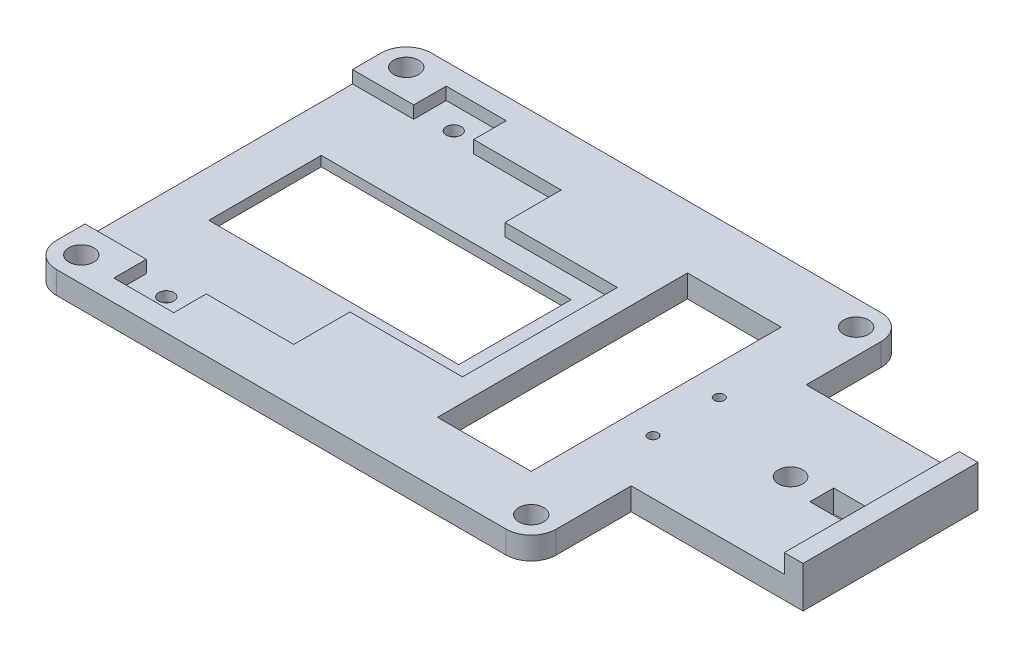
from build123d import *

# Parameters (mm, degrees)
SKETCH2_W                = 136.525
SKETCH2_H                = 76.2
CHASSIS_BASE_DEPTH       = 4.572
SKETCH2_2_W              = 136.525
SKETCH2_2_H              = 76.2
BOSS_EXTRUDE2_DEPTH      = 4.572
SKETCH4_W                = 34.925
SKETCH4_H                = 20.32
CORNER_CUTOUTS_DEPTH     = 79.308888961
CUT_EXTRUDE2_DEPTH       = 2.54
CIRCLE_R                 = 1.524
CIRCLE_THROUGH_ALL_DEPTH = 79.216561585
FILLET4_R                = 5.08
SKETCH10_W               = 50.8
SKETCH10_H               = 22.86
RESISTANCE_SENSOR_DEPTH  = 79.216561585
SKETCH11_R               = 2.54
CORNER_HOLES_DEPTH       = 79.308888961
CUT_EXTRUDE7_DEPTH       = 79.216561585
CUT_EXTRUDE7_DEPTH_BACK  = 79.216561585
SKETCH12_R               = 1.016
SKETCH12_W               = 19.05
SKETCH12_H               = 50.8
SKETCH16_W               = 6.35
SKETCH16_H               = 4.826
CUT_EXTRUDE11_DEPTH      = 79.308888961
SKETCH17_R               = 2.4892
CUT_EXTRUDE12_DEPTH      = 79.308888961
CUT_EXTRUDE13_DEPTH      = 1.27
SKETCH19_W               = 3.81
SKETCH19_H               = 35.56
BOSS_EXTRUDE4_DEPTH      = 3.81


with BuildPart() as part:
    # Sketch2 → Chassis Base (new body)
    with BuildSketch(Plane(origin=(0, 0, 0), x_dir=(1, 0, 0), z_dir=(0, 1, 0))):
        Rectangle(SKETCH2_W, SKETCH2_H)
    extrude(amount=CHASSIS_BASE_DEPTH)

    # Sketch2<2> → Boss-Extrude2 (add)
    with BuildSketch(Plane(origin=(0, 0, 0), x_dir=(1, 0, 0), z_dir=(0, 1, 0))):
        Rectangle(SKETCH2_2_W, SKETCH2_2_H)
    extrude(amount=BOSS_EXTRUDE2_DEPTH)

    # Sketch4 → Corner Cutouts (cut, through all)
    with BuildSketch(Plane.XZ):
        with Locations((50.8, -27.94)):
            Rectangle(SKETCH4_W, SKETCH4_H)
        with Locations((50.8, 27.94)):
            Rectangle(SKETCH4_W, SKETCH4_H)
    extrude(amount=-CORNER_CUTOUTS_DEPTH, mode=Mode.SUBTRACT)

    # Lines → Cut-Extrude2 (cut)
    with BuildSketch(Plane(origin=(0, 4.572, 0), x_dir=(1, 0, 0), z_dir=(0, 1, 0))):
        Polygon((-68.2625, -27.178), (-55.8165, -27.178), (-55.8165, -33.782), (-43.6245, -33.782), (-43.6245, -27.178), (-25.8445, -27.178), (-25.8445, -15.748), (-2.9845, -15.748), (-2.9845, 15.748), (-25.8445, 15.748), (-25.8445, 27.178), (-43.6245, 27.178), (-43.6245, 33.782), (-55.8165, 33.782), (-55.8165, 27.178), (-68.2625, 27.178), align=None)
    extrude(amount=-CUT_EXTRUDE2_DEPTH, mode=Mode.SUBTRACT)

    # Circle → Circle Through All (cut, through all)
    with BuildSketch(Plane(origin=(0, 2.032, 0), x_dir=(1, 0, 0), z_dir=(0, 1, 0))):
        with Locations(Location((-49.7205, -29.21, 0), (0, 0, 270))):
            Circle(CIRCLE_R)
        with Locations(Location((-49.7205, 29.21, 0), (0, 0, 90))):
            Circle(CIRCLE_R)
    extrude(amount=-CIRCLE_THROUGH_ALL_DEPTH, mode=Mode.SUBTRACT)

    # Fillet4
    fillet4_edges = [part.edges().sort_by_distance(p)[0] for p in [
        (33.3375, 2.286, -38.1),
        (33.3375, 2.286, 38.1),
        (-68.2625, 2.286, -38.1),
        (-68.2625, 2.286, 38.1),
    ]]
    fillet(fillet4_edges, radius=FILLET4_R)

    # Sketch10 → resistance sensor (cut, through all)
    with BuildSketch(Plane(origin=(0, 2.032, 0), x_dir=(1, 0, 0), z_dir=(0, 1, 0))):
        with Locations((-33.4645, 0)):
            Rectangle(SKETCH10_W, SKETCH10_H)
    extrude(amount=-RESISTANCE_SENSOR_DEPTH, mode=Mode.SUBTRACT)

    # Sketch11 → corner holes (cut, through all)
    with BuildSketch(Plane(origin=(0, 4.572, 0), x_dir=(1, 0, 0), z_dir=(0, 1, 0))):
        with Locations(Location((-63.1825, 33.02, 0), (0, 0, 270))):
            Circle(SKETCH11_R)
        with Locations(Location((28.2575, 33.02, 0), (0, 0, 90))):
            Circle(SKETCH11_R)
        with Locations(Location((-63.1825, -33.02, 0), (0, 0, 90))):
            Circle(SKETCH11_R)
        with Locations(Location((28.2575, -33.02, 0), (0, 0, 270))):
            Circle(SKETCH11_R)
    extrude(amount=-CORNER_HOLES_DEPTH, mode=Mode.SUBTRACT)

    # Sketch12 → Cut-Extrude7 (cut, two sides: drawn at the far end of the back side and taken through both)
    with BuildSketch(Plane(origin=(0, 2.032, 0), x_dir=(1, 0, 0), z_dir=(0, 1, 0)).offset(-CUT_EXTRUDE7_DEPTH_BACK)):
        with Locations(Location((26.7335, -6.731, 0), (0, 0, 270))):
            Circle(SKETCH12_R)
        with Locations(Location((26.7335, 6.731, 0), (0, 0, 90))):
            Circle(SKETCH12_R)
        with Locations((11.1125, 0)):
            Rectangle(SKETCH12_W, SKETCH12_H)
    extrude(amount=CUT_EXTRUDE7_DEPTH + CUT_EXTRUDE7_DEPTH_BACK, mode=Mode.SUBTRACT)

    # Sketch16 → Cut-Extrude11 (cut, through all)
    with BuildSketch(Plane(origin=(0, 4.572, 0), x_dir=(1, 0, 0), z_dir=(0, 1, 0))):
        with Locations((57.4675, 0)):
            Rectangle(SKETCH16_W, SKETCH16_H)
    extrude(amount=-CUT_EXTRUDE11_DEPTH, mode=Mode.SUBTRACT)

    # Sketch17 → Cut-Extrude12 (cut, through all)
    with BuildSketch(Plane(origin=(0, 4.572, 0), x_dir=(1, 0, 0), z_dir=(0, 1, 0))):
        with Locations(Location((47.9425, 0, 0), (0, 0, 270))):
            Circle(SKETCH17_R)
    extrude(amount=-CUT_EXTRUDE12_DEPTH, mode=Mode.SUBTRACT)

    # Sketch18 → Cut-Extrude13 (cut)
    # profile 1 of 5: a face of its own
    with BuildSketch(Plane.XZ):
        with BuildLine():
            add(Edge.make_bspline(
                [(-33.702772205, -32.937203509), (-33.703598143, -33.02845504), (-33.705333053, -33.220131806), (-33.705378986, -33.521319359), (-33.709066322, -33.849800879), (-33.712761289, -34.138175691), (-33.714963296, -34.374614628), (-33.718439752, -34.546867394), (-33.721526048, -34.710761461), (-33.724612791, -34.865938747), (-33.72789546, -35.013090421), (-33.730587927, -35.151550246), (-33.735112427, -35.281601123), (-33.737993241, -35.365288069), (-33.739385689, -35.405738309)],
                knots=[0, 0, 0, 0, 1.330626348, 2.7950233, 4.391685999, 6.12059717, 7.000305762, 7.839416787, 8.632773681, 9.390544697, 10.102563453, 10.778998041, 11.409826442, 12, 12, 12, 12], degree=3))
            add(Edge.make_bspline(
                [(-33.739385689, -35.405738309), (-33.768327502, -35.409234362), (-33.83248073, -35.416983812), (-33.938141271, -35.429526589), (-34.062641053, -35.444079448), (-34.199605701, -35.460468397), (-34.336402659, -35.474890146), (-34.460092543, -35.489102134), (-34.564431712, -35.49920428), (-34.627550021, -35.505459716), (-34.65579444, -35.508258922)],
                knots=[0, 0, 0, 0, 0.75871927, 1.681798207, 2.769238559, 4.021041382, 5.271823924, 6.349219828, 7.26130266, 8, 8, 8, 8], degree=3))
            Line((-34.65579444, -35.508258922), (-34.690872443, -35.633794368))
            Line((-34.690872443, -35.633794368), (-31.888414176, -35.633794368))
            Line((-31.888414176, -35.633794368), (-31.917958117, -35.508258922))
            add(Edge.make_bspline(
                [(-31.917958117, -35.508258922), (-31.94519292, -35.505432324), (-32.007975814, -35.498916323), (-32.114793949, -35.488841023), (-32.24651708, -35.474708008), (-32.395177404, -35.460442989), (-32.543351452, -35.444452526), (-32.674806168, -35.429726522), (-32.781201209, -35.417460189), (-32.843906764, -35.409283924), (-32.871098858, -35.405738309)],
                knots=[0, 0, 0, 0, 0.685471795, 1.5801805, 2.685974342, 4.001975441, 5.318873838, 6.416921702, 7.313502363, 8, 8, 8, 8], degree=3))
            add(Edge.make_bspline(
                [(-32.871098858, -35.405738309), (-32.874138312, -35.320659894), (-32.880589906, -35.140071021), (-32.885476038, -34.853018948), (-32.894092619, -34.53434684), (-32.898315756, -34.19327846), (-32.902545611, -33.849452346), (-32.905663218, -33.522012459), (-32.907865964, -33.221075479), (-32.908471188, -33.02928289), (-32.908759492, -32.937920679)],
                knots=[0, 0, 0, 0, 0.827787113, 1.757074824, 2.79152534, 3.927552477, 5.073705597, 6.13505851, 7.111617519, 8, 8, 8, 8], degree=3))
            Line((-32.908759492, -32.937920679), (-32.907714385, -32.60758102))
            add(Edge.make_bspline(
                [(-32.907714385, -32.60758102), (-32.907861914, -32.531482837), (-32.908168994, -32.373085708), (-32.90565813, -32.126816918), (-32.902343534, -31.862847889), (-32.899826982, -31.634770862), (-32.894883149, -31.452080957), (-32.893441615, -31.324776533), (-32.890456586, -31.20968499), (-32.885676819, -31.107210678), (-32.882771665, -31.016875079), (-32.880052488, -30.938721487), (-32.875690702, -30.872484003), (-32.87252916, -30.8324094), (-32.871098858, -30.814279395)],
                knots=[0, 0, 0, 0, 1.527084951, 3.178602462, 4.942148896, 6.824739446, 7.755670849, 8.60950548, 9.379539168, 10.065885191, 10.668053807, 11.193301322, 11.635044395, 12, 12, 12, 12], degree=3))
            add(Edge.make_bspline(
                [(-32.871098858, -30.814279395), (-32.775178336, -30.816375101), (-32.582476854, -30.820585312), (-32.292786393, -30.839576476), (-32.001201884, -30.870593955), (-31.759192401, -30.903372857), (-31.571970644, -30.935633002), (-31.443807878, -30.959247373), (-31.329128742, -30.984449322), (-31.227090289, -31.009248014), (-31.138232094, -31.034937095), (-31.062429595, -31.062177121), (-30.999371199, -31.089458511), (-30.96348015, -31.111044647), (-30.947268158, -31.120795108)],
                knots=[0, 0, 0, 0, 1.761064907, 3.537927135, 5.327106968, 7.14307567, 8.01968469, 8.81438351, 9.535076163, 10.174712332, 10.74185694, 11.231870149, 11.653035633, 12, 12, 12, 12], degree=3))
            add(Edge.make_bspline(
                [(-30.947268158, -31.120795108), (-30.946391758, -31.143458533), (-30.944531559, -31.191562689), (-30.94543048, -31.268999734), (-30.944897718, -31.355826869), (-30.946533225, -31.486265533), (-30.951334144, -31.66062272), (-30.956246741, -31.802874042), (-30.958775574, -31.876100037)],
                knots=[0, 0, 0, 0, 0.540260251, 1.146727055, 1.844579267, 2.608938745, 4.254400499, 6, 6, 6, 6], degree=3))
            Line((-30.958775574, -31.876100037), (-30.832195022, -31.919036265))
            add(Edge.make_bspline(
                [(-30.832195022, -31.919036265), (-30.830117163, -31.896702772), (-30.825474294, -31.846799741), (-30.817475281, -31.76475329), (-30.805186845, -31.66832746), (-30.792868066, -31.557758279), (-30.779786175, -31.432781757), (-30.762290679, -31.294163583), (-30.7449934, -31.140982052), (-30.725461629, -30.97887355), (-30.706363399, -30.817020179), (-30.687561291, -30.665674785), (-30.669967123, -30.52964835), (-30.652898401, -30.409435499), (-30.638498637, -30.304389663), (-30.625125277, -30.214725705), (-30.612474102, -30.140517028), (-30.604513088, -30.096281615), (-30.600999555, -30.076758654)],
                knots=[0, 0, 0, 0, 0.579771428, 1.295469156, 2.130605229, 3.092125012, 4.171097047, 5.378518324, 6.703360754, 8.155632211, 9.598953579, 10.915923518, 12.097637568, 13.14415905, 14.054286067, 14.838241834, 15.487266906, 16, 16, 16, 16], degree=3))
            Line((-30.600999555, -30.076758654), (-30.781578329, -30.105475091))
            add(Edge.make_bspline(
                [(-30.781578329, -30.105475091), (-30.789518553, -30.143998715), (-30.806198417, -30.224924501), (-30.828331171, -30.345683623), (-30.849565879, -30.457079623), (-30.864513215, -30.52557071), (-30.870900762, -30.554839475)],
                knots=[0, 0, 0, 0, 1.030142935, 2.16400017, 3.215409641, 4, 4, 4, 4], degree=3))
            add(Edge.make_bspline(
                [(-30.870900762, -30.554839475), (-30.883445808, -30.556323123), (-30.914744569, -30.560024692), (-30.971651332, -30.563720773), (-31.04801904, -30.56788432), (-31.143925294, -30.571994272), (-31.259375172, -30.575769834), (-31.394276438, -30.581781204), (-31.549156013, -30.585026556), (-31.783795056, -30.592748084), (-32.095186039, -30.600485644), (-32.481227455, -30.606461873), (-32.878761634, -30.610774302), (-33.147973164, -30.611837885), (-33.284319699, -30.612376554)],
                knots=[0, 0, 0, 0, 0.188322618, 0.469847995, 0.849958105, 1.328735339, 1.901024075, 2.572223004, 3.341983892, 4.21063745, 6.072535026, 7.986090696, 9.967090691, 12, 12, 12, 12], degree=3))
            add(Edge.make_bspline(
                [(-33.284319699, -30.612376554), (-33.533303403, -30.610894644), (-34.02225272, -30.607984498), (-34.566956607, -30.596874691), (-34.912428586, -30.585010848), (-35.062078606, -30.581752933), (-35.193491765, -30.575756484), (-35.306850432, -30.571985279), (-35.402056205, -30.567834621), (-35.479468612, -30.563644403), (-35.538808582, -30.559958994), (-35.572210829, -30.55632018), (-35.585802864, -30.554839475)],
                knots=[0, 0, 0, 0, 3.244040555, 6.37058324, 7.0978683, 7.747816289, 8.32072437, 8.811738682, 9.225579453, 9.562275481, 9.82188124, 10, 10, 10, 10], degree=3))
            add(Edge.make_bspline(
                [(-35.585802864, -30.554839475), (-35.590559934, -30.513365183), (-35.600382748, -30.427725451), (-35.610618123, -30.301358685), (-35.619859633, -30.185947443), (-35.624570523, -30.114772548), (-35.626601884, -30.084081555)],
                knots=[0, 0, 0, 0, 1.059980831, 2.188740799, 3.218975397, 4, 4, 4, 4], degree=3))
            Line((-35.626601884, -30.084081555), (-35.778291568, -30.054858399))
            add(Edge.make_bspline(
                [(-35.778291568, -30.054858399), (-35.779109696, -30.1315546), (-35.780779991, -30.288138198), (-35.787694661, -30.52777808), (-35.802252217, -30.777410364), (-35.819070712, -31.030610979), (-35.839855131, -31.2738087), (-35.855139777, -31.494046279), (-35.872885045, -31.683923455), (-35.882635398, -31.800772007), (-35.887087933, -31.854131334)],
                knots=[0, 0, 0, 0, 1.020902502, 2.08428298, 3.190586408, 4.348989111, 5.461787099, 6.439309197, 7.287304727, 8, 8, 8, 8], degree=3))
            Line((-35.887087933, -31.854131334), (-35.725192363, -31.809162102))
            add(Edge.make_bspline(
                [(-35.725192363, -31.809162102), (-35.71545437, -31.74706555), (-35.695910507, -31.622439619), (-35.665327308, -31.440288698), (-35.635518725, -31.271767194), (-35.606395568, -31.168052242), (-35.593125765, -31.120795108)],
                knots=[0, 0, 0, 0, 1.07526635, 2.158027564, 3.160715617, 4, 4, 4, 4], degree=3))
            add(Edge.make_bspline(
                [(-35.593125765, -31.120795108), (-35.580361155, -31.112201424), (-35.552835473, -31.093669953), (-35.504809627, -31.068556822), (-35.44731879, -31.043847269), (-35.38048627, -31.01918181), (-35.304711923, -30.993420032), (-35.219034508, -30.970551023), (-35.124453848, -30.944772249), (-35.019973119, -30.919513038), (-34.904098663, -30.896616073), (-34.776123041, -30.875510362), (-34.635107521, -30.858141399), (-34.480918893, -30.843472759), (-34.313785766, -30.832525065), (-34.133859008, -30.822847413), (-33.940979163, -30.816637469), (-33.808085796, -30.815082992), (-33.739385689, -30.814279395)],
                knots=[0, 0, 0, 0, 0.389041187, 0.838930788, 1.368286178, 1.971244365, 2.640738876, 3.392006404, 4.213672846, 5.120859182, 6.110426022, 7.200997897, 8.401287125, 9.703895375, 11.118645378, 12.637995816, 14.261989656, 16, 16, 16, 16], degree=3))
            add(Edge.make_bspline(
                [(-33.739385689, -30.814279395), (-33.737942282, -30.830664591), (-33.734658791, -30.867937979), (-33.730430536, -30.930351173), (-33.727743346, -31.005717111), (-33.724503155, -31.093587246), (-33.721396793, -31.194367242), (-33.718365122, -31.308049063), (-33.71488523, -31.434966911), (-33.712742323, -31.618756603), (-33.708988428, -31.849591328), (-33.705457404, -32.117398445), (-33.70501216, -32.368478864), (-33.704206333, -32.530279453), (-33.703817312, -32.608390135)],
                knots=[0, 0, 0, 0, 0.329934336, 0.750541551, 1.254589287, 1.842509769, 2.514318579, 3.277018032, 4.123623988, 5.061003967, 6.963739231, 8.754478227, 10.433195345, 12, 12, 12, 12], degree=3))
            Line((-33.703817312, -32.608390135), (-33.702772205, -32.937203509))
        make_face()
    # profile 2 of 5: a face of its own
    with BuildSketch(Plane.XZ):
        with BuildLine():
            add(Edge.make_bspline(
                [(-27.251898172, -35.767698843), (-27.14067772, -35.764311776), (-26.922618032, -35.757671068), (-26.603830965, -35.716600121), (-26.29995869, -35.655080644), (-26.012210018, -35.566590368), (-25.739973448, -35.454956469), (-25.484537959, -35.317447754), (-25.243276324, -35.158734883), (-25.058153285, -35.004443988), (-24.918608884, -34.871624623), (-24.821536956, -34.765448835), (-24.73028793, -34.655561965), (-24.645253494, -34.541149573), (-24.566386092, -34.422046989), (-24.495969307, -34.29686386), (-24.429098445, -34.168454969), (-24.37125937, -34.03416413), (-24.318119325, -33.895936844), (-24.274151327, -33.752229577), (-24.233417449, -33.604654162), (-24.201673879, -33.451490367), (-24.175027198, -33.29383193), (-24.15719632, -33.131349802), (-24.142449612, -32.964669116), (-24.139507996, -32.851822621), (-24.138016377, -32.794601046)],
                knots=[0, 0, 0, 0, 1.654520043, 3.24386492, 4.775090929, 6.261827658, 7.715597549, 9.145277746, 10.571150381, 12.004552925, 12.72368617, 13.435937959, 14.143336704, 14.847838136, 15.555750295, 16.266773003, 16.983694851, 17.708494173, 18.440755566, 19.185660995, 19.943230337, 20.717524926, 21.511536697, 22.321039648, 23.148642092, 24, 24, 24, 24], degree=3))
            add(Edge.make_bspline(
                [(-24.138016377, -32.794601046), (-24.140608697, -32.706567622), (-24.145780113, -32.530949878), (-24.188341569, -32.270081443), (-24.256306284, -32.013806886), (-24.335599704, -31.805961834), (-24.411662626, -31.644829689), (-24.475552614, -31.528458756), (-24.546054751, -31.417207878), (-24.622286016, -31.310483813), (-24.705022118, -31.208407771), (-24.795273204, -31.112744285), (-24.890649221, -31.02087723), (-24.958527768, -30.964177657), (-24.992703534, -30.935630326)],
                knots=[0, 0, 0, 0, 1.497468564, 2.987297775, 4.485800779, 6.00346457, 6.76531872, 7.516957734, 8.261133263, 9.005498066, 9.747896811, 10.495259908, 11.242387355, 12, 12, 12, 12], degree=3))
            add(Edge.make_bspline(
                [(-24.992703534, -30.935630326), (-25.070246118, -30.885909145), (-25.222151893, -30.788505447), (-25.46169693, -30.67203661), (-25.70152636, -30.578019856), (-25.946993732, -30.513524114), (-26.197838356, -30.469689092), (-26.457591706, -30.437773454), (-26.728005827, -30.421213243), (-26.911981221, -30.421028741), (-27.005455175, -30.420935)],
                knots=[0, 0, 0, 0, 1.045468158, 2.048070122, 3.019776725, 3.967121396, 4.925071677, 5.910597291, 6.938419277, 8, 8, 8, 8], degree=3))
            add(Edge.make_bspline(
                [(-27.005455175, -30.420935), (-27.067546223, -30.422967782), (-27.19008247, -30.426979464), (-27.371116469, -30.439978031), (-27.546831513, -30.456762048), (-27.71694268, -30.482701932), (-27.88164765, -30.512809725), (-28.041245371, -30.54746318), (-28.194098466, -30.591900434), (-28.342995206, -30.637320101), (-28.485415938, -30.693076932), (-28.62356261, -30.751716604), (-28.755286785, -30.817985236), (-28.881711554, -30.889502), (-29.00262107, -30.966555992), (-29.118323138, -31.049543348), (-29.228384901, -31.138584721), (-29.366176208, -31.264407076), (-29.523971995, -31.431248144), (-29.691760883, -31.64365229), (-29.832359501, -31.869379538), (-29.949688599, -32.105407946), (-30.039676747, -32.353732723), (-30.104302518, -32.613159857), (-30.146663933, -32.883546862), (-30.152426812, -33.068179332), (-30.155348724, -33.161792223)],
                knots=[0, 0, 0, 0, 0.955876937, 1.886416398, 2.792499174, 3.671270352, 4.533252654, 5.369032349, 6.182765502, 6.982075569, 7.763369315, 8.534891058, 9.290804328, 10.030916141, 10.769236196, 11.495940819, 12.220840406, 12.946355399, 14.365929964, 15.749574664, 17.104431243, 18.45069603, 19.798521208, 21.15982306, 22.559965237, 24, 24, 24, 24], degree=3))
            add(Edge.make_bspline(
                [(-30.155348724, -33.161792223), (-30.15430078, -33.247295021), (-30.152242406, -33.415239842), (-30.12544672, -33.661577318), (-30.080784096, -33.897628672), (-30.015676038, -34.124589938), (-29.927459876, -34.345973854), (-29.807685562, -34.560273908), (-29.664977474, -34.774936399), (-29.550121962, -34.908262158), (-29.491056992, -34.976825537)],
                knots=[0, 0, 0, 0, 1.034515342, 2.031997759, 2.994717118, 3.939165266, 4.885977753, 5.871954466, 6.905642885, 8, 8, 8, 8], degree=3))
            add(Edge.make_bspline(
                [(-29.491056992, -34.976825537), (-29.448662443, -35.017134707), (-29.365323353, -35.096374365), (-29.233306218, -35.204229185), (-29.100080082, -35.302769582), (-28.96386678, -35.390007201), (-28.824948465, -35.465156686), (-28.685050486, -35.531750493), (-28.541914085, -35.586442729), (-28.349186902, -35.643489326), (-28.107923503, -35.698404191), (-27.819876596, -35.743318797), (-27.534927157, -35.768959701), (-27.346192823, -35.768117594), (-27.251898172, -35.767698843)],
                knots=[0, 0, 0, 0, 0.861291258, 1.693124039, 2.508722345, 3.300843965, 4.073052942, 4.833508039, 5.581284352, 6.327029741, 7.792114048, 9.221606161, 10.61839766, 12, 12, 12, 12], degree=3))
        make_face()
        with BuildLine():
            add(Edge.make_bspline(
                [(-26.895829263, -35.508258922), (-26.984523637, -35.502704186), (-27.158480619, -35.491809638), (-27.412028501, -35.445592731), (-27.652978609, -35.378433913), (-27.880543049, -35.285047473), (-28.095934044, -35.170064436), (-28.298367191, -35.030344156), (-28.488194237, -34.867806404), (-28.662417156, -34.682962493), (-28.820157571, -34.483230278), (-28.959925816, -34.273913906), (-29.078722386, -34.056063184), (-29.177689924, -33.830504178), (-29.255349712, -33.59618112), (-29.311737639, -33.353526538), (-29.347925153, -33.102844981), (-29.355445616, -32.932806754), (-29.359244775, -32.846907481)],
                knots=[0, 0, 0, 0, 1.062649301, 2.084182544, 3.077508181, 4.050770289, 5.021569289, 5.993828993, 6.988205842, 8.006520951, 9.028378007, 10.030629867, 11.014727188, 11.993884368, 12.974321098, 13.964231378, 14.971578057, 16, 16, 16, 16], degree=3))
            add(Edge.make_bspline(
                [(-29.359244775, -32.846907481), (-29.35434531, -32.754034104), (-29.344824985, -32.573568536), (-29.30825802, -32.312805485), (-29.253510281, -32.070964136), (-29.178885157, -31.84838559), (-29.086336977, -31.644304506), (-28.973393809, -31.459929079), (-28.843182536, -31.293698759), (-28.693654648, -31.148937999), (-28.533126646, -31.022731598), (-28.367229368, -30.912271687), (-28.197248711, -30.818141536), (-28.021526333, -30.742656122), (-27.841157941, -30.683934534), (-27.656366173, -30.641804376), (-27.466780141, -30.617133728), (-27.338893512, -30.614667924), (-27.274310253, -30.613422683)],
                knots=[0, 0, 0, 0, 1.302559707, 2.531050155, 3.684202301, 4.771875286, 5.814676407, 6.816822024, 7.794260883, 8.765083759, 9.724965173, 10.65181382, 11.554869737, 12.443376475, 13.327128818, 14.208934328, 15.095504675, 16, 16, 16, 16], degree=3))
            add(Edge.make_bspline(
                [(-27.274310253, -30.613422683), (-27.197799992, -30.61744998), (-27.04664853, -30.625406194), (-26.82455963, -30.664227035), (-26.612101487, -30.728594423), (-26.406715756, -30.811018916), (-26.212282085, -30.921209064), (-26.025044976, -31.050785247), (-25.847749195, -31.205194522), (-25.680585013, -31.3797719), (-25.526659194, -31.572849669), (-25.39172642, -31.782587468), (-25.27599895, -32.006708616), (-25.180397287, -32.245616611), (-25.105792988, -32.499432487), (-25.04922129, -32.767278919), (-25.012071835, -33.04958225), (-25.004099937, -33.242929353), (-25.000026435, -33.341726362)],
                knots=[0, 0, 0, 0, 0.932804582, 1.842821793, 2.737983766, 3.633357388, 4.532843208, 5.454388191, 6.403114053, 7.39159831, 8.39538157, 9.406392926, 10.424767149, 11.463676078, 12.536241667, 13.643519346, 14.795879348, 16, 16, 16, 16], degree=3))
            add(Edge.make_bspline(
                [(-25.000026435, -33.341726362), (-25.003348326, -33.417148103), (-25.009861674, -33.565030131), (-25.040127994, -33.781820346), (-25.084018741, -33.98897831), (-25.146541829, -34.186341439), (-25.224822755, -34.373748255), (-25.319647987, -34.551494654), (-25.429850191, -34.719922936), (-25.555732757, -34.876407326), (-25.693161744, -35.019875601), (-25.840833712, -35.145541302), (-25.996455962, -35.253482939), (-26.160914972, -35.341644137), (-26.332936809, -35.41230882), (-26.513705369, -35.463424881), (-26.702229511, -35.49791247), (-26.831302231, -35.504781043), (-26.895829263, -35.508258922)],
                knots=[0, 0, 0, 0, 1.134750352, 2.22494442, 3.287456516, 4.315732293, 5.333470747, 6.337539811, 7.341115772, 8.355823464, 9.353463168, 10.324393736, 11.266969937, 12.196088049, 13.125102564, 14.057913, 15.016630478, 16, 16, 16, 16], degree=3))
        make_face(mode=Mode.SUBTRACT)
    # profile 3 of 5: a face of its own
    with BuildSketch(Plane.XZ):
        with BuildLine():
            Line((-18.464989099, -35.633794368), (-16.107700484, -35.633794368))
            Line((-16.107700484, -35.633794368), (-16.1438522, -35.508258922))
            add(Edge.make_bspline(
                [(-16.1438522, -35.508258922), (-16.163277141, -35.505564373), (-16.204735866, -35.499813386), (-16.270648109, -35.488550282), (-16.345484558, -35.47881806), (-16.454008656, -35.462187112), (-16.588742339, -35.440487367), (-16.694543353, -35.417670957), (-16.745024775, -35.406784437)],
                knots=[0, 0, 0, 0, 0.578804289, 1.235344231, 1.973318314, 2.805923195, 4.475992485, 6, 6, 6, 6], degree=3))
            add(Edge.make_bspline(
                [(-16.745024775, -35.406784437), (-16.751708635, -35.380296951), (-16.766897974, -35.320103079), (-16.790721529, -35.219341766), (-16.817705292, -35.097511868), (-16.849164999, -34.955254925), (-16.884537912, -34.792364444), (-16.924528791, -34.608646148), (-16.968423092, -34.404365572), (-17.064727716, -33.941565386), (-17.215548353, -33.21846), (-17.363162332, -32.489037148), (-17.459343294, -32.004039138), (-17.504645776, -31.779253976), (-17.545381148, -31.571060065), (-17.582085206, -31.379981598), (-17.61407958, -31.206177288), (-17.644109263, -31.049806813), (-17.668653765, -30.910155793), (-17.684421225, -30.822643456), (-17.691771259, -30.781849405)],
                knots=[0, 0, 0, 0, 0.312451515, 0.710058559, 1.184198332, 1.7396684, 2.376473493, 3.090718614, 3.890202177, 4.766301273, 8.497490808, 12.338885421, 13.278308136, 14.152807913, 14.961608928, 15.704725426, 16.378254723, 16.982936425, 17.525893779, 18, 18, 18, 18], degree=3))
            add(Edge.make_bspline(
                [(-17.691771259, -30.781849405), (-17.669131533, -30.776837051), (-17.621182689, -30.76622135), (-17.544621814, -30.752177341), (-17.460128759, -30.735767102), (-17.370294443, -30.722326691), (-17.283087928, -30.709294518), (-17.205338409, -30.697694404), (-17.140485238, -30.688228141), (-17.10140849, -30.682798085), (-17.083970478, -30.68037492)],
                knots=[0, 0, 0, 0, 0.902777855, 1.912000022, 3.030478334, 4.253737315, 5.448096633, 6.463873442, 7.314503002, 8, 8, 8, 8], degree=3))
            Line((-17.083970478, -30.68037492), (-17.062183621, -30.553794368))
            Line((-17.062183621, -30.553794368), (-19.043467628, -30.553796411))
            Line((-19.043467628, -30.553796411), (-19.007310805, -30.679330835))
            add(Edge.make_bspline(
                [(-19.007310805, -30.679330835), (-18.969812338, -30.68561721), (-18.889058377, -30.699155088), (-18.763746293, -30.719945446), (-18.636241484, -30.743538155), (-18.554627723, -30.769567995), (-18.516120683, -30.781849405)],
                knots=[0, 0, 0, 0, 0.908126762, 1.955675498, 3.03544595, 4, 4, 4, 4], degree=3))
            add(Edge.make_bspline(
                [(-18.516120683, -30.781849405), (-18.519802807, -30.796191783), (-18.529053225, -30.832223438), (-18.550878132, -30.895353133), (-18.580033426, -30.979076947), (-18.617721208, -31.082782901), (-18.665159821, -31.206444983), (-18.721699548, -31.350308655), (-18.786329249, -31.51478305), (-18.939891874, -31.893578893), (-19.182848797, -32.487839471), (-19.43111394, -33.085070492), (-19.599397416, -33.478142366), (-19.676125472, -33.656177379), (-19.744565634, -33.817345434), (-19.807680598, -33.960363215), (-19.862719411, -34.086237875), (-19.91202828, -34.193774374), (-19.953965551, -34.284048902), (-19.979630465, -34.338349682), (-19.991162166, -34.362747984)],
                knots=[0, 0, 0, 0, 0.206330486, 0.518353994, 0.930327389, 1.442349601, 2.056186141, 2.776467501, 3.596923127, 4.519366629, 8.473700556, 12.545727429, 13.534334062, 14.433589585, 15.247961308, 15.974919263, 16.612542044, 17.162837773, 17.623848182, 18, 18, 18, 18], degree=3))
            add(Edge.make_bspline(
                [(-19.991162166, -34.362747984), (-20.010028796, -34.315337994), (-20.050492072, -34.213657751), (-20.114717847, -34.049919103), (-20.185014162, -33.863948044), (-20.265383659, -33.656579669), (-20.351458375, -33.426840922), (-20.446256614, -33.175313792), (-20.546886621, -32.90148121), (-20.654864135, -32.613092701), (-20.761844593, -32.323287047), (-20.863758017, -32.045870995), (-20.95627045, -31.787484977), (-21.042747426, -31.548990618), (-21.119601067, -31.32932801), (-21.189984897, -31.129742361), (-21.252064638, -30.949571312), (-21.289528115, -30.83559096), (-21.307192085, -30.781849405)],
                knots=[0, 0, 0, 0, 0.64193762, 1.376764149, 2.212685415, 3.143094487, 4.174628561, 5.299096029, 6.524724979, 7.844822574, 9.173146152, 10.411125717, 11.562902579, 12.625852621, 13.602639804, 14.490607553, 15.288323868, 16, 16, 16, 16], degree=3))
            add(Edge.make_bspline(
                [(-21.307192085, -30.781849405), (-21.268191378, -30.772533637), (-21.186283458, -30.752968986), (-21.056729302, -30.727467173), (-20.915260729, -30.701831993), (-20.816610901, -30.687716964), (-20.765297412, -30.68037492)],
                knots=[0, 0, 0, 0, 0.872324183, 1.832024741, 2.872310515, 4, 4, 4, 4], degree=3))
            Line((-20.765297412, -30.68037492), (-20.735509306, -30.553794368))
            Line((-20.735509306, -30.553794368), (-22.861410391, -30.553796411))
            Line((-22.861410391, -30.553796411), (-22.818024655, -30.679330835))
            add(Edge.make_bspline(
                [(-22.818024655, -30.679330835), (-22.801921181, -30.682189713), (-22.762897406, -30.689117674), (-22.694387817, -30.699067679), (-22.605857243, -30.711915111), (-22.502516692, -30.725331329), (-22.393437769, -30.740812038), (-22.288771037, -30.755073767), (-22.192569574, -30.768974845), (-22.131542771, -30.777673872), (-22.102249905, -30.781849405)],
                knots=[0, 0, 0, 0, 0.542804679, 1.315386201, 2.297446092, 3.511966529, 4.773923042, 5.954041894, 7.017940109, 8, 8, 8, 8], degree=3))
            add(Edge.make_bspline(
                [(-22.102249905, -30.781849405), (-22.10846636, -30.814639799), (-22.122236585, -30.887274616), (-22.146359616, -31.006527301), (-22.176234592, -31.146094654), (-22.207534841, -31.306605203), (-22.247564538, -31.486813022), (-22.289497885, -31.688296826), (-22.338198198, -31.909877321), (-22.443495575, -32.399653202), (-22.611150085, -33.145759988), (-22.77749708, -33.890326573), (-22.891839815, -34.370310081), (-22.940770275, -34.584544674), (-22.98912888, -34.77620332), (-23.029571805, -34.946555355), (-23.069358252, -35.094306017), (-23.102004467, -35.220505557), (-23.131352015, -35.324780037), (-23.150371899, -35.386588893), (-23.158839903, -35.414107338)],
                knots=[0, 0, 0, 0, 0.379247946, 0.840081546, 1.382532271, 2.001122798, 2.698273829, 3.480113498, 4.339723504, 5.276271099, 9.172834759, 13.029477518, 13.945454042, 14.779748709, 15.52649882, 16.191559413, 16.769196364, 17.265149568, 17.672830999, 18, 18, 18, 18], degree=3))
            add(Edge.make_bspline(
                [(-23.158839903, -35.414107338), (-23.201968987, -35.424744383), (-23.291202868, -35.446752379), (-23.426097946, -35.469477413), (-23.553983728, -35.489057801), (-23.634836377, -35.502274824), (-23.671442972, -35.508258922)],
                knots=[0, 0, 0, 0, 1.022016422, 2.114547405, 3.146348313, 4, 4, 4, 4], degree=3))
            Line((-23.671442972, -35.508258922), (-23.721894164, -35.633794368))
            Line((-23.721894164, -35.633794368), (-21.841846607, -35.633794368))
            Line((-21.841846607, -35.633794368), (-21.870769409, -35.508258922))
            add(Edge.make_bspline(
                [(-21.870769409, -35.508258922), (-21.889706112, -35.505897905), (-21.932427066, -35.500571481), (-22.003544453, -35.489629344), (-22.089344678, -35.477205488), (-22.185309703, -35.463376982), (-22.281929594, -35.448515407), (-22.370473241, -35.43367543), (-22.446561812, -35.420407712), (-22.493168935, -35.411051458), (-22.514424617, -35.406784437)],
                knots=[0, 0, 0, 0, 0.702734036, 1.585358755, 2.649590685, 3.895430199, 5.155876833, 6.249455525, 7.201645292, 8, 8, 8, 8], degree=3))
            add(Edge.make_bspline(
                [(-22.514424617, -35.406784437), (-22.51389444, -35.34086223), (-22.512796997, -35.204406087), (-22.500809766, -34.993107167), (-22.486397191, -34.767953267), (-22.460768553, -34.529615494), (-22.432277993, -34.276946679), (-22.395156553, -34.010940308), (-22.352085716, -33.730930947), (-22.30367346, -33.441525348), (-22.250895138, -33.150042351), (-22.201542654, -32.863886892), (-22.151755378, -32.58753126), (-22.10503763, -32.320643404), (-22.059154813, -32.063616479), (-22.013651825, -31.81618984), (-21.971056463, -31.578316087), (-21.943235928, -31.422778001), (-21.929638668, -31.346758909)],
                knots=[0, 0, 0, 0, 0.770431899, 1.594761011, 2.473197984, 3.407207202, 4.396093415, 5.445178443, 6.54618504, 7.70740775, 8.874723163, 10.008511827, 11.101454274, 12.156854393, 13.175424493, 14.153160355, 15.097358873, 16, 16, 16, 16], degree=3))
            Line((-21.929638668, -31.346758909), (-21.899693233, -31.346548458))
            add(Edge.make_bspline(
                [(-21.899693233, -31.346548458), (-21.893067649, -31.367237281), (-21.877290961, -31.416501022), (-21.845896451, -31.501097948), (-21.807740018, -31.61021163), (-21.759561764, -31.742707294), (-21.701791227, -31.8983655), (-21.635965354, -32.077760991), (-21.560545693, -32.280674123), (-21.387406027, -32.744172658), (-21.117515051, -33.465134924), (-20.844322951, -34.187962811), (-20.662377807, -34.660875179), (-20.580912373, -34.873774139), (-20.506491329, -35.064675209), (-20.441000794, -35.23444864), (-20.382124685, -35.381700925), (-20.33204521, -35.507780574), (-20.289286356, -35.61196107), (-20.263185256, -35.67425706), (-20.251648215, -35.701792734)],
                knots=[0, 0, 0, 0, 0.251873741, 0.599755847, 1.046100481, 1.592272547, 2.234489471, 2.971361359, 3.80808277, 4.744657452, 8.708649747, 12.734665194, 13.704869525, 14.584207812, 15.377909045, 16.080745818, 16.694199686, 17.216797744, 17.65381397, 18, 18, 18, 18], degree=3))
            add(Edge.make_bspline(
                [(-20.251648215, -35.701792734), (-20.239417209, -35.676349866), (-20.211505803, -35.61828872), (-20.165275515, -35.520351489), (-20.112918976, -35.400131684), (-20.050457029, -35.259579199), (-19.980854496, -35.097063485), (-19.901029869, -34.913729786), (-19.814619268, -34.708358861), (-19.620634823, -34.248399598), (-19.324532522, -33.539140091), (-19.02868709, -32.829223237), (-18.838408351, -32.36655658), (-18.752017618, -32.16002438), (-18.675288703, -31.97422503), (-18.605686063, -31.81001305), (-18.546262905, -31.666462036), (-18.495298388, -31.544287271), (-18.451995347, -31.443335406), (-18.426152113, -31.383025307), (-18.414646198, -31.356174068)],
                knots=[0, 0, 0, 0, 0.323097448, 0.737314984, 1.239386854, 1.823722409, 2.497644016, 3.262748589, 4.112229015, 5.047662212, 8.976026174, 12.908685672, 13.849949603, 14.701564875, 15.470904606, 16.150603782, 16.742804927, 17.24904711, 17.665661037, 18, 18, 18, 18], degree=3))
            Line((-18.414646198, -31.356174068), (-18.385448582, -31.355253597))
            add(Edge.make_bspline(
                [(-18.385448582, -31.355253597), (-18.380598966, -31.385211409), (-18.369922713, -31.451162434), (-18.350873822, -31.559193533), (-18.327753161, -31.685344024), (-18.301366403, -31.830365546), (-18.272714823, -31.993740419), (-18.238733126, -32.175676625), (-18.201117085, -32.375778474), (-18.119206279, -32.815508303), (-17.994920299, -33.481040352), (-17.873601109, -34.142736498), (-17.795052511, -34.565870031), (-17.763579877, -34.750980865), (-17.733363105, -34.914239752), (-17.709592281, -35.056629927), (-17.689757845, -35.17798459), (-17.673522035, -35.277942143), (-17.663354031, -35.356897534), (-17.657593015, -35.402250881), (-17.655156754, -35.421430239)],
                knots=[0, 0, 0, 0, 0.396651626, 0.873214011, 1.433742613, 2.072949179, 2.79980602, 3.601671395, 4.492008083, 5.461019541, 9.447939965, 13.341079234, 14.253823992, 15.072824383, 15.795194721, 16.423849787, 16.959593355, 17.402445839, 17.747301876, 18, 18, 18, 18], degree=3))
            add(Edge.make_bspline(
                [(-17.655156754, -35.421430239), (-17.680610271, -35.424239575), (-17.737794552, -35.430551074), (-17.832395201, -35.440493807), (-17.944829144, -35.455118019), (-18.068785136, -35.467971516), (-18.190621606, -35.483206067), (-18.297256141, -35.492059516), (-18.381387175, -35.50297238), (-18.430322365, -35.506674754), (-18.451260703, -35.508258922)],
                knots=[0, 0, 0, 0, 0.76741832, 1.724094307, 2.850468363, 4.164887635, 5.458538831, 6.529550762, 7.370825724, 8, 8, 8, 8], degree=3))
            Line((-18.451260703, -35.508258922), (-18.464989099, -35.633794368))
        make_face()
    # profile 4 of 5: a face of its own
    with BuildSketch(Plane.XZ):
        with BuildLine():
            add(Edge.make_bspline(
                [(-11.273772637, -33.242592385), (-11.274439814, -33.46115382), (-11.275786162, -33.902206147), (-11.282480344, -34.39657081), (-11.285896647, -34.720537359), (-11.289341456, -34.864893053), (-11.29239867, -34.993568473), (-11.295474487, -35.106554062), (-11.298717617, -35.203839765), (-11.301378408, -35.285481198), (-11.305587453, -35.35138628), (-11.308936635, -35.390050867), (-11.31038612, -35.406784437)],
                knots=[0, 0, 0, 0, 3.028851979, 6.112158886, 6.851591277, 7.518630885, 8.113202523, 8.635311525, 9.084965802, 9.462177826, 9.767237008, 10, 10, 10, 10], degree=3))
            add(Edge.make_bspline(
                [(-11.31038612, -35.406784437), (-11.340669603, -35.413676666), (-11.404442713, -35.428190811), (-11.506096785, -35.445473895), (-11.618077561, -35.461192403), (-11.735046224, -35.473718713), (-11.846702153, -35.48454033), (-11.942235024, -35.494077786), (-12.01694943, -35.500914626), (-12.059422349, -35.506092032), (-12.077198466, -35.508258922)],
                knots=[0, 0, 0, 0, 0.962742302, 2.02741116, 3.195519987, 4.468213233, 5.674133405, 6.673510737, 7.444826758, 8, 8, 8, 8], degree=3))
            Line((-12.077198466, -35.508258922), (-12.105332585, -35.633794368))
            Line((-12.105332585, -35.633794368), (-9.591677355, -35.633794368))
            Line((-9.591677355, -35.633794368), (-9.620759529, -35.508258922))
            add(Edge.make_bspline(
                [(-9.620759529, -35.508258922), (-9.644861692, -35.506147827), (-9.697206405, -35.501562983), (-9.781355568, -35.494624111), (-9.877223622, -35.484859855), (-10.019360231, -35.469949034), (-10.202608108, -35.446607325), (-10.348748271, -35.419980796), (-10.421176716, -35.406784437)],
                knots=[0, 0, 0, 0, 0.539497797, 1.17167315, 1.882709678, 2.688156165, 4.358618926, 6, 6, 6, 6], degree=3))
            add(Edge.make_bspline(
                [(-10.421176716, -35.406784437), (-10.423355065, -35.386916283), (-10.428241507, -35.342348331), (-10.434233417, -35.267687014), (-10.440733313, -35.178095367), (-10.44550472, -35.073079686), (-10.450734139, -34.953125476), (-10.456234584, -34.818191688), (-10.459974996, -34.66821944), (-10.465721545, -34.452039552), (-10.470511033, -34.181780099), (-10.474425787, -33.870373881), (-10.47809292, -33.581646695), (-10.478512648, -33.396823514), (-10.478713795, -33.308250243)],
                knots=[0, 0, 0, 0, 0.342636229, 0.768596579, 1.283965761, 1.882525891, 2.57066071, 3.342418964, 4.197626401, 5.142474103, 7.049835918, 8.831480119, 10.481542375, 12, 12, 12, 12], degree=3))
            Line((-10.478713795, -33.308250243), (-10.478713795, -33.089610364))
            add(Edge.make_bspline(
                [(-10.478713795, -33.089610364), (-10.416639799, -33.090443101), (-10.286877701, -33.092183891), (-10.083828243, -33.099281027), (-9.863818232, -33.113688047), (-9.67198871, -33.128315258), (-9.517590337, -33.143503593), (-9.409212409, -33.155056077), (-9.311515955, -33.171826032), (-9.222793972, -33.186236211), (-9.14481688, -33.205533307), (-9.076457714, -33.224862378), (-9.018068374, -33.246423454), (-8.983992265, -33.264331882), (-8.968103936, -33.272681867)],
                knots=[0, 0, 0, 0, 1.460054225, 3.052158871, 4.777747245, 6.645306086, 7.576443567, 8.426900201, 9.207584446, 9.907398832, 10.539969914, 11.095367996, 11.578206203, 12, 12, 12, 12], degree=3))
            add(Edge.make_bspline(
                [(-8.968103936, -33.272681867), (-8.962561471, -33.328449649), (-8.951522119, -33.439526604), (-8.940801705, -33.602469271), (-8.932781771, -33.753125616), (-8.931895168, -33.848392904), (-8.931489431, -33.891990064)],
                knots=[0, 0, 0, 0, 1.083509771, 2.158109244, 3.157095713, 4, 4, 4, 4], degree=3))
            Line((-8.931489431, -33.891990064), (-8.804908879, -33.934677019))
            add(Edge.make_bspline(
                [(-8.804908879, -33.934677019), (-8.799588577, -33.79139919), (-8.788796492, -33.500764095), (-8.76600663, -33.139197996), (-8.741508755, -32.857016318), (-8.725764298, -32.664365998), (-8.707398049, -32.492565556), (-8.695444891, -32.384863286), (-8.689833699, -32.334304413)],
                knots=[0, 0, 0, 0, 1.60798525, 3.261753419, 4.062339447, 4.784657842, 5.429479703, 6, 6, 6, 6], degree=3))
            Line((-8.689833699, -32.334304413), (-8.834806297, -32.355688755))
            add(Edge.make_bspline(
                [(-8.834806297, -32.355688755), (-8.841162933, -32.393208366), (-8.854204265, -32.470183942), (-8.874835685, -32.584343747), (-8.893411103, -32.693466476), (-8.9108653, -32.761908325), (-8.918935887, -32.793554917)],
                knots=[0, 0, 0, 0, 1.023788563, 2.100413966, 3.12165692, 4, 4, 4, 4], degree=3))
            add(Edge.make_bspline(
                [(-8.918935887, -32.793554917), (-8.938420064, -32.798295683), (-8.98063964, -32.808568282), (-9.049196875, -32.820331131), (-9.126870842, -32.832441624), (-9.213996079, -32.840528152), (-9.310011055, -32.85223217), (-9.415459448, -32.859740353), (-9.530169842, -32.867343622), (-9.691301994, -32.875082651), (-9.88763612, -32.883149939), (-10.106931879, -32.892301189), (-10.301202341, -32.896537154), (-10.422221433, -32.896935642), (-10.478713795, -32.897121659)],
                knots=[0, 0, 0, 0, 0.460983456, 0.998888806, 1.598786594, 2.26823328, 3.010291425, 3.822708578, 4.698538602, 5.653966456, 7.532036023, 9.217167566, 10.700958888, 12, 12, 12, 12], degree=3))
            Line((-10.478713795, -32.897121659), (-10.478713795, -32.733950099))
            add(Edge.make_bspline(
                [(-10.478713795, -32.733950099), (-10.478514722, -32.649901729), (-10.478095935, -32.473090198), (-10.474314584, -32.195167563), (-10.470871811, -31.891415555), (-10.464444148, -31.626414509), (-10.459093553, -31.414053019), (-10.454838831, -31.268642075), (-10.450968919, -31.140292137), (-10.446038449, -31.028670128), (-10.439143494, -30.934242214), (-10.434594431, -30.856736777), (-10.428875692, -30.796249645), (-10.422744129, -30.761948022), (-10.420130587, -30.747327158)],
                knots=[0, 0, 0, 0, 1.521705457, 3.201193203, 5.032271395, 7.021502972, 8.000415413, 8.878349948, 9.65531632, 10.325287411, 10.901059933, 11.369321384, 11.731176961, 12, 12, 12, 12], degree=3))
            add(Edge.make_bspline(
                [(-10.420130587, -30.747327158), (-10.391535004, -30.747567794), (-10.331538929, -30.74807267), (-10.236987251, -30.751118505), (-10.133798396, -30.757878592), (-10.021443573, -30.765885526), (-9.900508038, -30.777915751), (-9.770689123, -30.791036733), (-9.632369814, -30.808491416), (-9.488477684, -30.826070466), (-9.345740235, -30.847607891), (-9.210775473, -30.871879082), (-9.087217539, -30.901962296), (-8.973935472, -30.932259691), (-8.872304793, -30.967904878), (-8.781837865, -31.006760732), (-8.701668904, -31.047645138), (-8.654660504, -31.080200199), (-8.63229662, -31.095688019)],
                knots=[0, 0, 0, 0, 0.745412212, 1.563941097, 2.465474235, 3.44078858, 4.499925893, 5.633228068, 6.841852836, 8.133904223, 9.411712824, 10.604407001, 11.706776453, 12.725636009, 13.659933344, 14.510926994, 15.291584992, 16, 16, 16, 16], degree=3))
            add(Edge.make_bspline(
                [(-8.63229662, -31.095688019), (-8.629278376, -31.116585158), (-8.62285629, -31.161049178), (-8.617574806, -31.232382279), (-8.610767846, -31.311817923), (-8.606009732, -31.396602302), (-8.602204948, -31.479957753), (-8.598372539, -31.556301247), (-8.597983419, -31.622244011), (-8.597119571, -31.663039516), (-8.596728244, -31.681520097)],
                knots=[0, 0, 0, 0, 0.862638942, 1.835485362, 2.921946333, 4.121165674, 5.305387793, 6.332364251, 7.244552155, 8, 8, 8, 8], degree=3))
            Line((-8.596728244, -31.681520097), (-8.470147691, -31.740086959))
            add(Edge.make_bspline(
                [(-8.470147691, -31.740086959), (-8.469114218, -31.66511002), (-8.466984039, -31.510568725), (-8.456574037, -31.272081348), (-8.444102646, -31.020307548), (-8.429364282, -30.763225552), (-8.410402614, -30.516059505), (-8.392712793, -30.294095188), (-8.372066091, -30.104659011), (-8.355358679, -29.989891974), (-8.34774961, -29.937623535)],
                knots=[0, 0, 0, 0, 0.995506361, 2.051922148, 3.169085537, 4.342481069, 5.470604041, 6.460265785, 7.298757679, 8, 8, 8, 8], degree=3))
            Line((-8.34774961, -29.937623535), (-8.502890294, -29.973444249))
            add(Edge.make_bspline(
                [(-8.502890294, -29.973444249), (-8.508240768, -30.018708073), (-8.51945588, -30.113585423), (-8.535627366, -30.23268999), (-8.548922363, -30.327188868), (-8.558687532, -30.389903915), (-8.566589526, -30.442289007), (-8.572262036, -30.473948244), (-8.574759541, -30.487887237)],
                knots=[0, 0, 0, 0, 1.579215329, 3.310187927, 4.164533577, 4.885633696, 5.509364535, 6, 6, 6, 6], degree=3))
            add(Edge.make_bspline(
                [(-8.574759541, -30.487887237), (-8.595634174, -30.492044166), (-8.644058075, -30.501687195), (-8.727817815, -30.509278528), (-8.831928762, -30.519793066), (-8.956947976, -30.525669209), (-9.102628421, -30.533945247), (-9.269028386, -30.538381156), (-9.45628143, -30.54269733), (-9.657845501, -30.545632076), (-9.861150216, -30.547401181), (-10.053638749, -30.549430434), (-10.229032566, -30.551904934), (-10.387352686, -30.552663109), (-10.528580167, -30.553630992), (-10.652717311, -30.555097589), (-10.759773918, -30.5547901), (-10.825331174, -30.554823978), (-10.855320131, -30.554839475)],
                knots=[0, 0, 0, 0, 0.447197082, 1.037384759, 1.766156545, 2.647384005, 3.667698219, 4.833919275, 6.146513728, 7.60556834, 9.071861591, 10.420863621, 11.652575644, 12.759595974, 13.749321587, 14.621753255, 15.369525425, 16, 16, 16, 16], degree=3))
            add(Edge.make_bspline(
                [(-10.855320131, -30.554839475), (-10.897514846, -30.554562531), (-10.989230544, -30.553960558), (-11.137072466, -30.551350159), (-11.305872962, -30.550071881), (-11.487873248, -30.545139001), (-11.668886728, -30.541919701), (-11.834506052, -30.536277933), (-11.97748881, -30.53131207), (-12.065344837, -30.527354279), (-12.105443941, -30.525547871)],
                knots=[0, 0, 0, 0, 0.809799648, 1.760204837, 2.837753184, 4.049360768, 5.254277663, 6.312195211, 7.229654905, 8, 8, 8, 8], degree=3))
            Line((-12.105443941, -30.525547871), (-12.076408761, -30.705522874))
            add(Edge.make_bspline(
                [(-12.076408761, -30.705522874), (-12.044948527, -30.708742486), (-11.979003298, -30.715491262), (-11.87590168, -30.724072309), (-11.764426734, -30.736372009), (-11.649222221, -30.74773049), (-11.539700596, -30.760914325), (-11.445237915, -30.773548528), (-11.370748001, -30.788665589), (-11.328453932, -30.801481572), (-11.31038612, -30.806956494)],
                knots=[0, 0, 0, 0, 0.98083855, 2.055980328, 3.208571069, 4.459097211, 5.646332609, 6.629822294, 7.414667014, 8, 8, 8, 8], degree=3))
            add(Edge.make_bspline(
                [(-11.31038612, -30.806956494), (-11.308950382, -30.825783654), (-11.305734967, -30.867948092), (-11.301397129, -30.938374683), (-11.298762559, -31.022805207), (-11.295504514, -31.121136133), (-11.292422412, -31.23307523), (-11.289348677, -31.358960541), (-11.28590456, -31.498782579), (-11.283721338, -31.701748745), (-11.279951948, -31.958388981), (-11.276447078, -32.259324184), (-11.276002842, -32.546669315), (-11.275206836, -32.733577105), (-11.274817744, -32.824938778)],
                knots=[0, 0, 0, 0, 0.33675085, 0.754171678, 1.258263211, 1.84315515, 2.508859089, 3.255382855, 4.0889495, 5.003240078, 6.875350917, 8.666545496, 10.370587017, 12, 12, 12, 12], degree=3))
            Line((-11.274817744, -32.824938778), (-11.273772637, -33.242592385))
        make_face()
    # profile 5 of 5: a face of its own
    with BuildSketch(Plane.XZ):
        with BuildLine():
            add(Edge.make_bspline(
                [(-6.921877198, -33.612442814), (-6.921590313, -33.692443095), (-6.921029137, -33.848931601), (-6.89570709, -34.077011264), (-6.856366935, -34.292525459), (-6.80153574, -34.495775812), (-6.727932009, -34.685480541), (-6.638449828, -34.862926828), (-6.532749228, -35.027792425), (-6.409700667, -35.179449579), (-6.269202346, -35.316666667), (-6.108529731, -35.435457357), (-5.928964151, -35.536535103), (-5.730285349, -35.618693343), (-5.51283193, -35.683326993), (-5.276633699, -35.731421435), (-5.021041201, -35.76009415), (-4.844336086, -35.765802524), (-4.753251359, -35.768744972)],
                knots=[0, 0, 0, 0, 1.098480814, 2.148737736, 3.147644891, 4.10655949, 5.03634168, 5.93840556, 6.832815652, 7.721755294, 8.616242375, 9.523684943, 10.459066836, 11.44050601, 12.471205295, 13.571501156, 14.748201731, 16, 16, 16, 16], degree=3))
            add(Edge.make_bspline(
                [(-4.753251359, -35.768744972), (-4.66602375, -35.767411804), (-4.49827547, -35.764847976), (-4.257242462, -35.743432205), (-4.037088132, -35.711209787), (-3.837469708, -35.664222914), (-3.656356977, -35.603176889), (-3.491792983, -35.528753033), (-3.341362545, -35.442712288), (-3.252693376, -35.373005412), (-3.209165381, -35.338786071)],
                knots=[0, 0, 0, 0, 1.279578065, 2.460769273, 3.547596216, 4.541609226, 5.465453356, 6.347033297, 7.188553055, 8, 8, 8, 8], degree=3))
            add(Edge.make_bspline(
                [(-3.209165381, -35.338786071), (-3.176006395, -35.306735019), (-3.110172703, -35.243101013), (-3.018693335, -35.141512093), (-2.936764391, -35.034364638), (-2.860115413, -34.924794464), (-2.794891564, -34.808844698), (-2.735737757, -34.689733482), (-2.685737764, -34.565718417), (-2.628030725, -34.393726668), (-2.573565037, -34.168176159), (-2.525921234, -33.886496108), (-2.49977553, -33.591213221), (-2.498465371, -33.389896585), (-2.497797857, -33.287327669)],
                knots=[0, 0, 0, 0, 0.74095243, 1.471083405, 2.194018666, 2.907422796, 3.617739347, 4.329446966, 5.043269096, 5.764464961, 7.243103234, 8.765857475, 10.352235051, 12, 12, 12, 12], degree=3))
            add(Edge.make_bspline(
                [(-2.497797857, -33.287327669), (-2.498277062, -33.21583868), (-2.499277656, -33.066567778), (-2.505168021, -32.838539572), (-2.511044655, -32.606325078), (-2.511983715, -32.451823241), (-2.512443659, -32.376149561)],
                knots=[0, 0, 0, 0, 0.941350568, 1.96556493, 3.003551083, 4, 4, 4, 4], degree=3))
            Line((-2.512443659, -32.376149561), (-2.512030929, -32.020008118))
            add(Edge.make_bspline(
                [(-2.512030929, -32.020008118), (-2.511810625, -31.981802847), (-2.511308813, -31.894778019), (-2.510703685, -31.74811013), (-2.506734043, -31.569238247), (-2.504497129, -31.402873877), (-2.499593602, -31.263433546), (-2.49830065, -31.165058053), (-2.49480963, -31.076849556), (-2.49158598, -30.998748527), (-2.489160585, -30.930678461), (-2.48400374, -30.872903453), (-2.481915154, -30.824984034), (-2.478415275, -30.796482643), (-2.476875283, -30.783941663)],
                knots=[0, 0, 0, 0, 1.112001644, 2.532942425, 4.268742887, 6.319307057, 7.375275201, 8.329527021, 9.182613282, 9.944420855, 10.604828803, 11.164515616, 11.632376063, 12, 12, 12, 12], degree=3))
            add(Edge.make_bspline(
                [(-2.476875283, -30.783941663), (-2.429521024, -30.773140167), (-2.337154385, -30.752071359), (-2.202417231, -30.727217928), (-2.080849412, -30.704228195), (-2.005043541, -30.68783462), (-1.970548987, -30.68037492)],
                knots=[0, 0, 0, 0, 1.127559202, 2.199355566, 3.180638315, 4, 4, 4, 4], degree=3))
            Line((-1.970548987, -30.68037492), (-1.926323487, -30.553794368))
            Line((-1.926323487, -30.553794368), (-3.998993579, -30.553796411))
            Line((-3.998993579, -30.553796411), (-3.94727457, -30.679330835))
            add(Edge.make_bspline(
                [(-3.94727457, -30.679330835), (-3.918827146, -30.68206314), (-3.857911872, -30.687913902), (-3.761128757, -30.698462497), (-3.652613433, -30.710864976), (-3.537292775, -30.726353034), (-3.422548973, -30.74153093), (-3.317088857, -30.755559901), (-3.225213017, -30.770740203), (-3.168369934, -30.779781321), (-3.142213143, -30.783941663)],
                knots=[0, 0, 0, 0, 0.84468969, 1.808757977, 2.877550512, 4.072885772, 5.247783381, 6.298734727, 7.217149455, 8, 8, 8, 8], degree=3))
            add(Edge.make_bspline(
                [(-3.142213143, -30.783941663), (-3.14034068, -30.807296994), (-3.136263689, -30.858149517), (-3.132623242, -30.940855506), (-3.128349239, -31.036394916), (-3.123952143, -31.144830108), (-3.121202729, -31.266554358), (-3.118060423, -31.401154841), (-3.114576868, -31.548648645), (-3.113131599, -31.704537759), (-3.110459036, -31.860400445), (-3.110278245, -32.007922099), (-3.107551635, -32.142158572), (-3.106303828, -32.263513754), (-3.107142284, -32.371272154), (-3.105267715, -32.466112892), (-3.105662531, -32.547715017), (-3.105618719, -32.597928957), (-3.105598638, -32.62094368)],
                knots=[0, 0, 0, 0, 0.611962318, 1.332450699, 2.162118907, 3.110096843, 4.16702893, 5.342335118, 6.62691553, 8.020625594, 9.414335659, 10.698657708, 11.87378741, 12.921297375, 13.868574921, 14.688384936, 15.398843096, 16, 16, 16, 16], degree=3))
            Line((-3.105598638, -32.62094368), (-3.104969327, -33.301362548))
            add(Edge.make_bspline(
                [(-3.104969327, -33.301362548), (-3.105722492, -33.408984213), (-3.107174716, -33.616496022), (-3.123012077, -33.916412967), (-3.15448595, -34.192997999), (-3.191235539, -34.409068271), (-3.230511513, -34.569436648), (-3.265249758, -34.681292377), (-3.305449025, -34.78683003), (-3.353370307, -34.885599848), (-3.40518491, -34.979151803), (-3.464083186, -35.066208177), (-3.528796372, -35.147100389), (-3.576644198, -35.196185471), (-3.600417519, -35.220573527)],
                knots=[0, 0, 0, 0, 1.903911934, 3.671047141, 5.310184092, 6.826502457, 7.544698343, 8.229584924, 8.897507391, 9.540432076, 10.170199064, 10.787884533, 11.397757162, 12, 12, 12, 12], degree=3))
            add(Edge.make_bspline(
                [(-3.600417519, -35.220573527), (-3.632188008, -35.249292207), (-3.695851197, -35.306840039), (-3.803683351, -35.37859025), (-3.919790362, -35.439722711), (-4.045130573, -35.490288489), (-4.181832676, -35.529308142), (-4.331185307, -35.555574964), (-4.49340832, -35.572795916), (-4.606048096, -35.574387592), (-4.664330418, -35.57521116)],
                knots=[0, 0, 0, 0, 0.892216608, 1.787865285, 2.692300372, 3.625548977, 4.601601837, 5.65154391, 6.784856638, 8, 8, 8, 8], degree=3))
            add(Edge.make_bspline(
                [(-4.664330418, -35.57521116), (-4.71462001, -35.575443793), (-4.813547884, -35.57590142), (-4.958687066, -35.554604334), (-5.097910901, -35.52071517), (-5.230349733, -35.469713626), (-5.357465774, -35.404487506), (-5.477512135, -35.322473635), (-5.591326949, -35.225183245), (-5.698961438, -35.112526503), (-5.798519714, -34.981515949), (-5.882466819, -34.827475387), (-5.956387404, -34.653998444), (-6.014534202, -34.458175521), (-6.062759278, -34.241864557), (-6.097755687, -34.00413375), (-6.119179964, -33.745203543), (-6.12420942, -33.565638464), (-6.126818356, -33.47249245)],
                knots=[0, 0, 0, 0, 0.831978421, 1.636637964, 2.422585838, 3.201433073, 3.981650011, 4.784316689, 5.603829326, 6.457736919, 7.361162631, 8.320562619, 9.35588812, 10.479611967, 11.698851246, 13.024714807, 14.456626667, 16, 16, 16, 16], degree=3))
            Line((-6.126818356, -33.47249245), (-6.126818356, -32.486628517))
            add(Edge.make_bspline(
                [(-6.126818356, -32.486628517), (-6.126328485, -32.314503761), (-6.125339376, -31.96696344), (-6.12138346, -31.577204841), (-6.114037073, -31.321663759), (-6.112547672, -31.207608583), (-6.10960346, -31.106112067), (-6.104809617, -31.017244857), (-6.101978445, -30.941199359), (-6.099164661, -30.877685814), (-6.095027477, -30.826770445), (-6.091656299, -30.796837888), (-6.090203851, -30.783941663)],
                knots=[0, 0, 0, 0, 3.031320133, 6.120595302, 6.86389742, 7.53339059, 8.129362652, 8.651934286, 9.100613388, 9.469540013, 9.771455147, 10, 10, 10, 10], degree=3))
            add(Edge.make_bspline(
                [(-6.090203851, -30.783941663), (-6.02646225, -30.772668901), (-5.894434014, -30.749319584), (-5.69494302, -30.723222882), (-5.502744773, -30.699948154), (-5.37919787, -30.686543384), (-5.322345377, -30.68037492)],
                knots=[0, 0, 0, 0, 1.002171925, 2.075802739, 3.11454347, 4, 4, 4, 4], degree=3))
            Line((-5.322345377, -30.68037492), (-5.284553978, -30.553794368))
            Line((-5.284553978, -30.553794368), (-7.550970377, -30.553796411))
            Line((-7.550970377, -30.553796411), (-7.529277509, -30.679330835))
            add(Edge.make_bspline(
                [(-7.529277509, -30.679330835), (-7.479189173, -30.687308093), (-7.378827087, -30.703292138), (-7.230235822, -30.727734541), (-7.08974538, -30.753369809), (-7.00026905, -30.774210642), (-6.958490682, -30.783941663)],
                knots=[0, 0, 0, 0, 1.048533566, 2.100948571, 3.1132932, 4, 4, 4, 4], degree=3))
            add(Edge.make_bspline(
                [(-6.958490682, -30.783941663), (-6.957065785, -30.800328192), (-6.953944945, -30.836218333), (-6.949537539, -30.895126691), (-6.946896698, -30.96387386), (-6.943636104, -31.042326831), (-6.940544234, -31.130205217), (-6.93748516, -31.22749706), (-6.934011444, -31.334536154), (-6.930549216, -31.574468275), (-6.923453906, -31.949994092), (-6.923101569, -32.2865259), (-6.922922306, -32.457747601)],
                knots=[0, 0, 0, 0, 0.294690285, 0.645437246, 1.058192809, 1.527124121, 2.052242108, 2.633554529, 3.271067089, 3.970889855, 6.932490569, 10, 10, 10, 10], degree=3))
            Line((-6.922922306, -32.457747601), (-6.921877198, -33.612442814))
        make_face()
    extrude(amount=-CUT_EXTRUDE13_DEPTH, mode=Mode.SUBTRACT)

    # Sketch19 → Boss-Extrude4 (add)
    with BuildSketch(Plane(origin=(0, 4.572, 0), x_dir=(1, 0, 0), z_dir=(0, 1, 0))):
        with Locations((66.3575, 0)):
            Rectangle(SKETCH19_W, SKETCH19_H)
    extrude(amount=BOSS_EXTRUDE4_DEPTH)


solid = part.part
